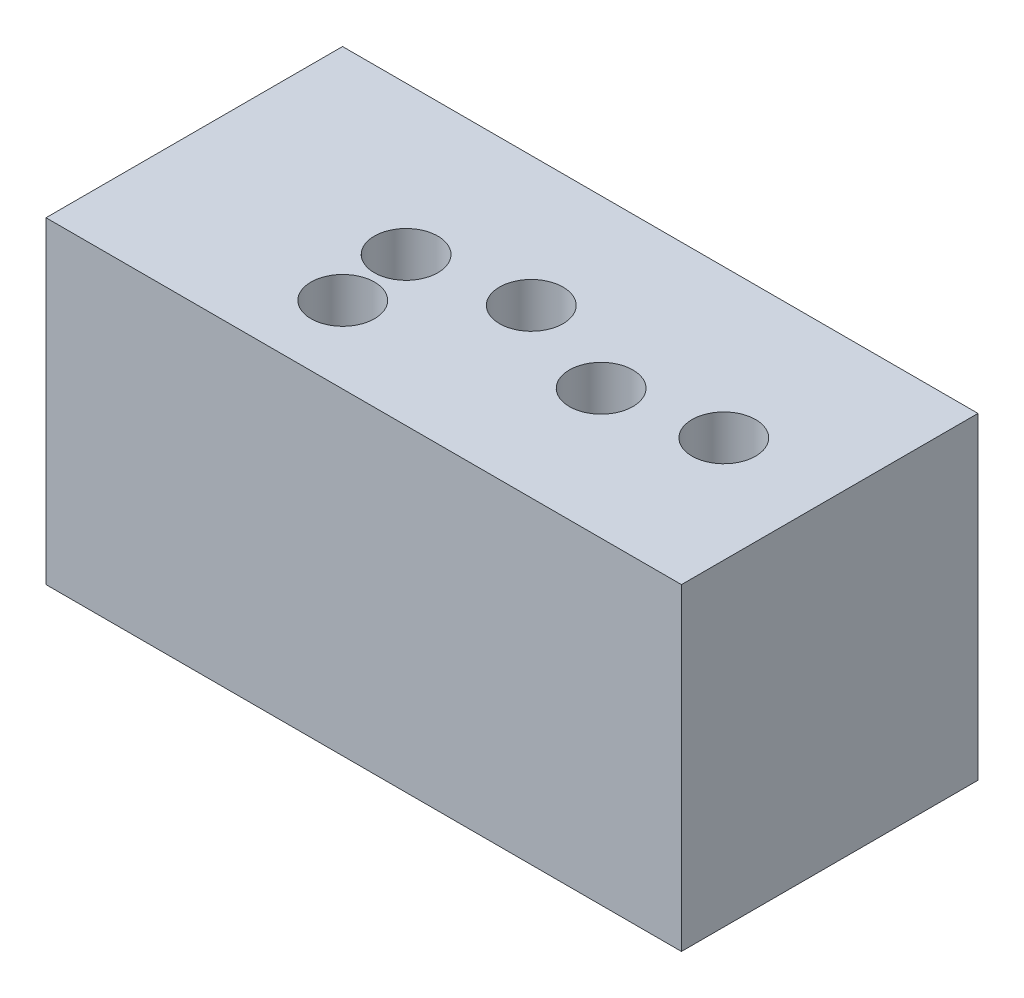
from build123d import *

# Parameters (mm, degrees)
SKETCH1_W           = 38.1
SKETCH1_H           = 17.78
BOSS_EXTRUDE1_DEPTH = 9.525
SKETCH2_R           = 1.905
CUT_EXTRUDE1_DEPTH  = 12.7


with BuildPart() as part:
    # Sketch1 → Boss-Extrude1 (new, symmetric)
    with BuildSketch(Plane(origin=(0, 0, 0), x_dir=(1, 0, 0), z_dir=(0, 1, 0))):
        with Locations((19.05, 8.89)):
            Rectangle(SKETCH1_W, SKETCH1_H)
    extrude(amount=BOSS_EXTRUDE1_DEPTH, both=True)

    # Sketch2 → Cut-Extrude1 (cut)
    with BuildSketch(Plane(origin=(0, 9.525, 0), x_dir=(1, 0, 0), z_dir=(0, 1, 0))):
        with Locations(Location((31.75, 8.89, 0), (0, 0, 270))):
            Circle(SKETCH2_R)
        with Locations(Location((19.098327334, 9.996877933, 0), (0, 0, 270))):
            Circle(SKETCH2_R)
        with Locations(Location((12.7, 8.89, 0), (0, 0, 270))):
            Circle(SKETCH2_R)
        with Locations(Location((25.496470768, 7.787334072, 0), (0, 0, 270))):
            Circle(SKETCH2_R)
        with Locations(Location((13.188250266, 4.604682415, 0), (0, 0, 270))):
            Circle(SKETCH2_R)
    extrude(amount=-CUT_EXTRUDE1_DEPTH, mode=Mode.SUBTRACT)


solid = part.part
